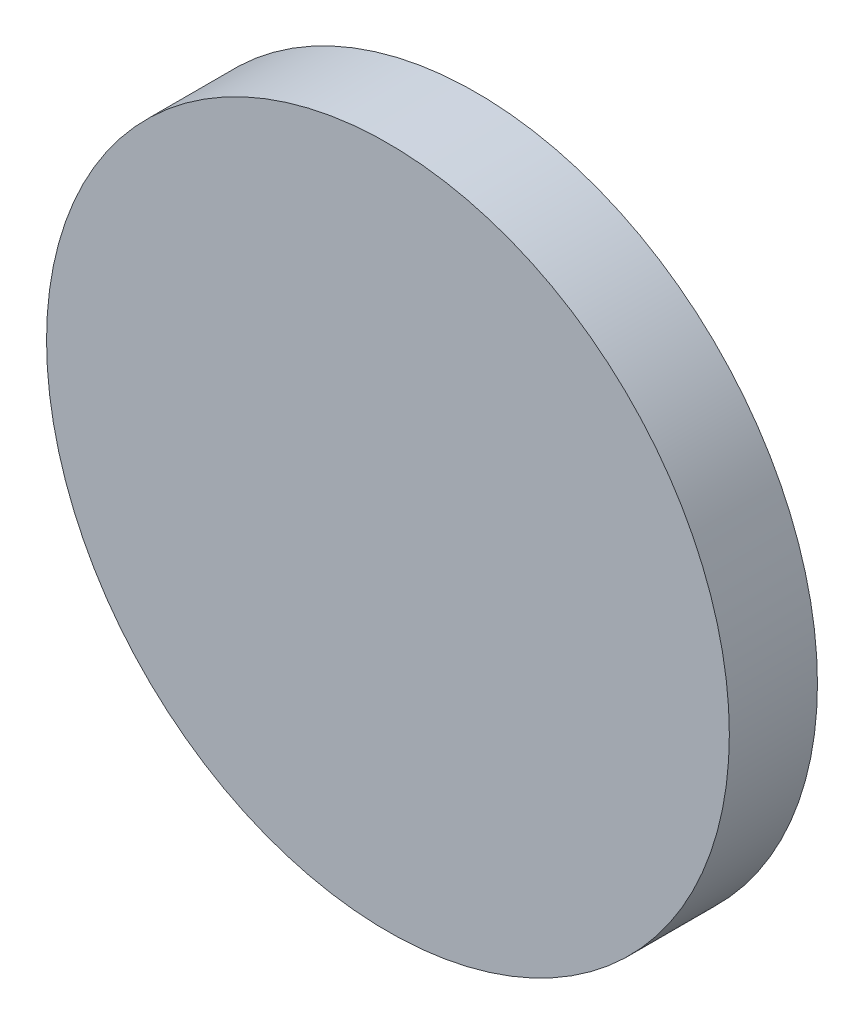
from build123d import *

# Parameters (mm, degrees)
SKETCH_1_R          = 38.75
EXTRUDE_1_DEPTH     = 10
SKETCH_2_R          = 37
CUT_EXTRUDE_1_DEPTH = 7


with BuildPart() as part:
    # 草图1 → 凸台-拉伸1 (new body)
    with BuildSketch(Plane.XY):
        Circle(SKETCH_1_R)
    extrude(amount=EXTRUDE_1_DEPTH)

    # 草图2 → 切除-拉伸1 (cut)
    with BuildSketch(Plane(origin=(0, 0, 0), x_dir=(-1, 0, 0), z_dir=(0, 0, -1))):
        Circle(SKETCH_2_R)
    extrude(amount=-CUT_EXTRUDE_1_DEPTH, mode=Mode.SUBTRACT)


solid = part.part
